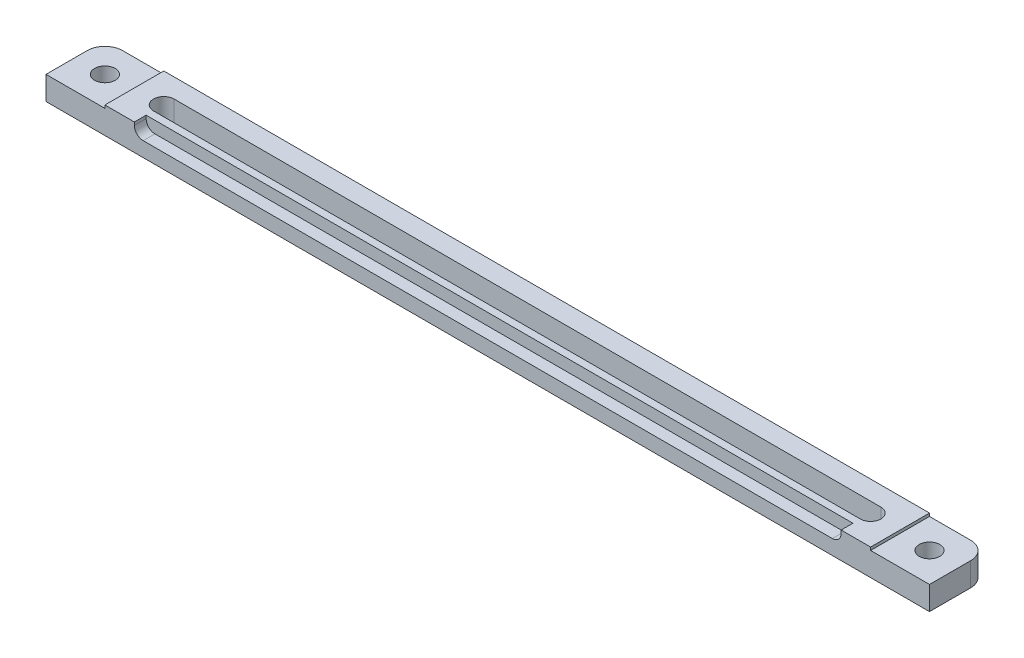
from build123d import *

# Parameters (mm, degrees)
SKETCH1_R           = 1.75
BOSS_EXTRUDE1_DEPTH = 4
SKETCH2_W           = 130
SKETCH2_H           = 10
BOSS_EXTRUDE2_DEPTH = 0.5
CUT_EXTRUDE1_DEPTH  = 2


with BuildPart() as part:
    # Sketch1 → Boss-Extrude1 (new body)
    with BuildSketch(Plane(origin=(0, 0, 0), x_dir=(1, 0, 0), z_dir=(0, 1, 0))):
        with BuildLine():
            ThreePointArc((75, 2), (74.121320344, 4.121320344), (72, 5))
            Line((72, 5), (-72, 5))
            ThreePointArc((-72, 5), (-74.121320344, 4.121320344), (-75, 2))
            Line((-75, 2), (-75, -5))
            Line((-75, -5), (75, -5))
            Line((75, -5), (75, 2))
        make_face()
        with Locations(Location((-70, 0, 0), (0, 0, 270))):
            Circle(SKETCH1_R, mode=Mode.SUBTRACT)
        with BuildLine():
            ThreePointArc((61.75, 0), (61.237436867, -1.237436867), (60, -1.75))
            Line((60, -1.75), (-60, -1.75))
            ThreePointArc((-60, -1.75), (-61.75, 0), (-60, 1.75))
            Line((-60, 1.75), (60, 1.75))
            ThreePointArc((60, 1.75), (61.237436867, 1.237436867), (61.75, 0))
        make_face(mode=Mode.SUBTRACT)
        with Locations(Location((70, 0, 0), (0, 0, 270))):
            Circle(SKETCH1_R, mode=Mode.SUBTRACT)
    extrude(amount=BOSS_EXTRUDE1_DEPTH)

    # Sketch2 → Boss-Extrude2 (add)
    with BuildSketch(Plane(origin=(0, 4, 0), x_dir=(1, 0, 0), z_dir=(0, 1, 0))):
        Rectangle(SKETCH2_W, SKETCH2_H)
        with BuildLine():
            Line((-60, 1.75), (60, 1.75))
            ThreePointArc((60, 1.75), (61.75, 0), (60, -1.75))
            Line((60, -1.75), (-60, -1.75))
            ThreePointArc((-60, -1.75), (-61.75, 0), (-60, 1.75))
        make_face(mode=Mode.SUBTRACT)
    extrude(amount=BOSS_EXTRUDE2_DEPTH)

    # Sketch3 → Cut-Extrude1 (cut)
    with BuildSketch(Plane.XY.offset(5)):
        with BuildLine():
            Line((-58.5, 2.5), (58.5, 2.5))
            ThreePointArc((58.5, 2.5), (59.560660172, 2.939339828), (60, 4))
            Line((60, 4), (60, 4.5))
            Line((60, 4.5), (-60, 4.5))
            Line((-60, 4.5), (-60, 4))
            ThreePointArc((-60, 4), (-59.560660172, 2.939339828), (-58.5, 2.5))
        make_face()
    extrude(amount=-CUT_EXTRUDE1_DEPTH, mode=Mode.SUBTRACT)


solid = part.part
